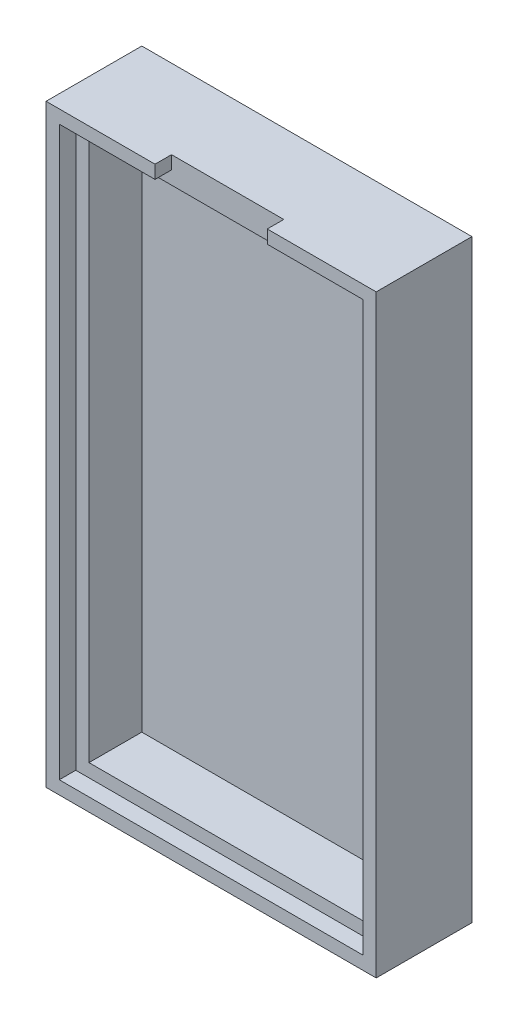
from build123d import *

# Parameters (mm, degrees)
SKETCH1_W           = 31.75
SKETCH1_H           = 57.15
BOSS_EXTRUDE1_DEPTH = 4.60375
SHELL1_T            = -2.54
SKETCH2_W           = 10.795
SKETCH2_H           = 1.5875
CUT_EXTRUDE1_DEPTH  = 2.54
SKETCH3_W           = 29.21
SKETCH3_H           = 54.61
CUT_EXTRUDE2_DEPTH  = 1.5875


with BuildPart() as part:
    # Sketch1 → Boss-Extrude1 (new, symmetric)
    with BuildSketch(Plane.XY):
        Rectangle(SKETCH1_W, SKETCH1_H)
    extrude(amount=BOSS_EXTRUDE1_DEPTH, both=True)

    # Shell1
    shell1_openings = [part.faces().sort_by_distance(p)[0] for p in [
        (0, 0, 4.60375),
    ]]
    offset(amount=SHELL1_T, openings=shell1_openings, kind=Kind.INTERSECTION)

    # Sketch2 → Cut-Extrude1 (cut)
    with BuildSketch(Plane(origin=(0, 28.575, 0), x_dir=(1, 0, 0), z_dir=(0, 1, 0))):
        with Locations((0, -3.81)):
            Rectangle(SKETCH2_W, SKETCH2_H)
    extrude(amount=-CUT_EXTRUDE1_DEPTH, mode=Mode.SUBTRACT)

    # Sketch3 → Cut-Extrude2 (cut)
    with BuildSketch(Plane.XY.offset(4.60375)):
        Rectangle(SKETCH3_W, SKETCH3_H)
    extrude(amount=-CUT_EXTRUDE2_DEPTH, mode=Mode.SUBTRACT)


solid = part.part
